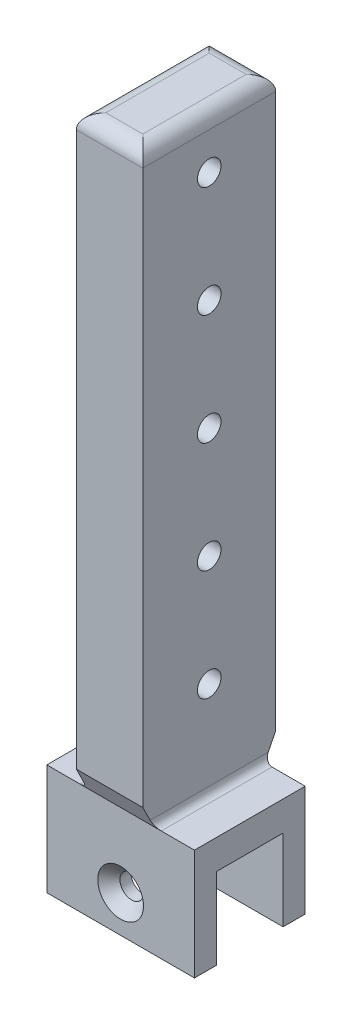
from build123d import *

# Parameters (mm, degrees)
SKETCH1_W           = 9
SKETCH1_H           = 18
BOSS_EXTRUDE1_DEPTH = 80
SKETCH2_W           = 20
SKETCH2_H           = 15
BOSS_EXTRUDE2_DEPTH = 15
SKETCH4_W           = 9
SKETCH4_H           = 11
CUT_EXTRUDE2_DEPTH  = 20
SKETCH5_R           = 1.6
CUT_EXTRUDE3_DEPTH  = 20
FILLET3_R           = 2
SKETCH6_R           = 1.6
CUT_EXTRUDE4_DEPTH  = 10
CUT_EXTRUDE5_DEPTH  = 10
FILLET8_R           = 1
CHAMFER1_SIZE       = 1.5


with BuildPart() as part:
    # Sketch1 → Boss-Extrude1 (new body)
    with BuildSketch(Plane(origin=(0, 0, 0), x_dir=(1, 0, 0), z_dir=(0, 1, 0))):
        with Locations((-4.5, 9)):
            Rectangle(SKETCH1_W, SKETCH1_H)
    extrude(amount=BOSS_EXTRUDE1_DEPTH)

    # Sketch2 → Boss-Extrude2 (add)
    with BuildSketch(Plane.XZ):
        with Locations((-4.5, -9)):
            Rectangle(SKETCH2_W, SKETCH2_H)
    extrude(amount=BOSS_EXTRUDE2_DEPTH)

    # Sketch4 → Cut-Extrude2 (cut)
    with BuildSketch(Plane(origin=(5.5, 0, 0), x_dir=(0, 0, -1), z_dir=(1, 0, 0))):
        with Locations((9, -9.5)):
            Rectangle(SKETCH4_W, SKETCH4_H)
    extrude(amount=-CUT_EXTRUDE2_DEPTH, mode=Mode.SUBTRACT)

    # Sketch5 → Cut-Extrude3 (cut)
    with BuildSketch(Plane(origin=(0, 0, -16.5), x_dir=(-1, 0, 0), z_dir=(0, 0, -1))):
        with Locations((4.5, -10)):
            Circle(SKETCH5_R)
    extrude(amount=-CUT_EXTRUDE3_DEPTH, mode=Mode.SUBTRACT)

    # Fillet3
    fillet3_edges = [part.edges().sort_by_distance(p)[0] for p in [
        (-9, 80, -9),
        (-4.5, 80, 0),
        (0, 80, -9),
        (-4.5, 80, -18),
    ]]
    fillet(fillet3_edges, radius=FILLET3_R)

    # Sketch6 → Cut-Extrude4 (cut)
    with BuildSketch(Plane(origin=(0, 0, 0), x_dir=(0, 0, -1), z_dir=(1, 0, 0))):
        with Locations((9, 73)):
            Circle(SKETCH6_R)
        with Locations((9, 58)):
            Circle(SKETCH6_R)
        with Locations((9, 43)):
            Circle(SKETCH6_R)
        with Locations((9, 28)):
            Circle(SKETCH6_R)
        with Locations((9, 13)):
            Circle(SKETCH6_R)
    extrude(amount=-CUT_EXTRUDE4_DEPTH, mode=Mode.SUBTRACT)

    # Sketch7 → Cut-Extrude5 (cut)
    with BuildSketch(Plane.ZY.offset(9)):
        Polygon((-16.5, 0), (-18, 3), (-18, 0), align=None)
        Polygon((-1.5, 0), (0, 3), (0, 0), align=None)
    extrude(amount=-CUT_EXTRUDE5_DEPTH, mode=Mode.SUBTRACT)

    # Fillet8
    fillet8_edges = [part.edges().sort_by_distance(p)[0] for p in [
        (0, 0, -9),
        (-9, 0, -9),
    ]]
    fillet(fillet8_edges, radius=FILLET8_R)

    # Chamfer1
    chamfer1_edges = [part.edges().sort_by_distance(p)[0] for p in [
        (-2.9, -10, -1.5),
    ]]
    chamfer(chamfer1_edges, length=CHAMFER1_SIZE)


solid = part.part
